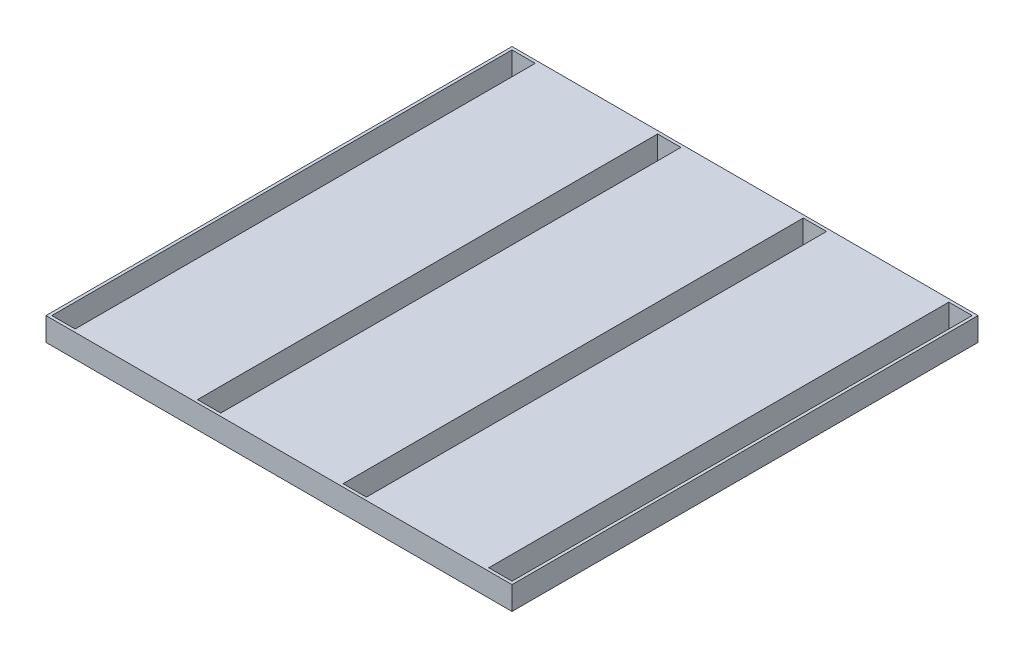
from build123d import *

# Parameters (mm, degrees)
SKETCH1_W           = 40
SKETCH1_H           = 40
SKETCH1_W_2         = 2
SKETCH1_H_2         = 39.5
BOSS_EXTRUDE4_DEPTH = 2


with BuildPart() as part:
    # Sketch1 → Boss-Extrude4 (new body)
    with BuildSketch(Plane(origin=(0, 0, 0), x_dir=(1, 0, 0), z_dir=(0, 1, 0))):
        with Locations((20, -20)):
            Rectangle(SKETCH1_W, SKETCH1_H)
        with Locations((13.75, -20)):
            Rectangle(SKETCH1_W_2, SKETCH1_H_2, mode=Mode.SUBTRACT)
        with Locations((1.25, -20)):
            Rectangle(SKETCH1_W_2, SKETCH1_H_2, mode=Mode.SUBTRACT)
        with Locations((26.25, -20)):
            Rectangle(SKETCH1_W_2, SKETCH1_H_2, mode=Mode.SUBTRACT)
        with Locations((38.75, -20)):
            Rectangle(SKETCH1_W_2, SKETCH1_H_2, mode=Mode.SUBTRACT)
    extrude(amount=BOSS_EXTRUDE4_DEPTH)


solid = part.part
